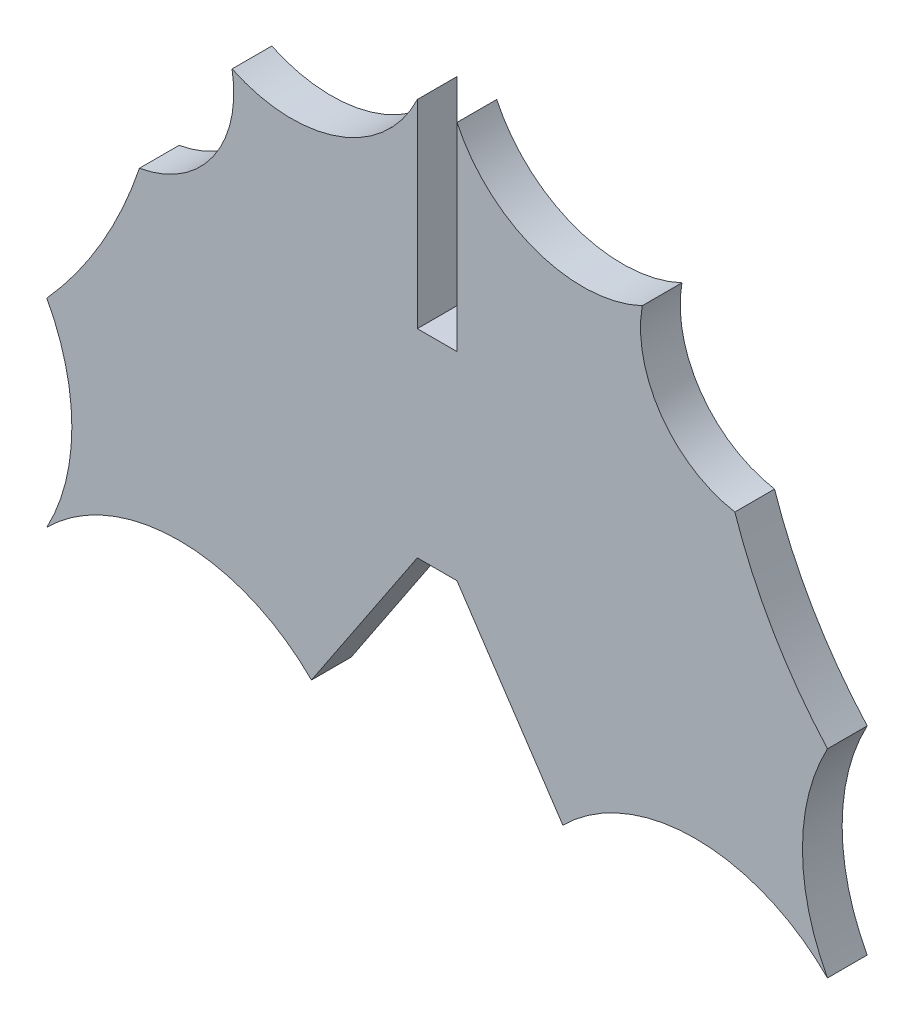
from build123d import *

# Parameters (mm, degrees)
SALIENTE_EXTRUIR2_DEPTH = 3


with BuildPart() as part:
    # Croquis1 → Saliente-Extruir2 (new body)
    with BuildSketch(Plane.XY):
        with BuildLine():
            Line((-7.016617782, 12.62270249), (-10.016617782, 12.62270249))
            Line((-10.016617782, 12.62270249), (-10.016617782, 27.62270249))
            ThreePointArc((-10.016617782, 27.62270249), (-15.981083876, 22.223207554), (-24.016617782, 22.62270249))
            ThreePointArc((-24.016617782, 22.62270249), (-25.44554997, 16.172955022), (-31.016617782, 12.62270249))
            ThreePointArc((-31.016617782, 12.62270249), (-33.901410943, 6.263831835), (-38.016617782, 0.62270249))
            ThreePointArc((-38.016617782, 0.62270249), (-36.124451454, -6.87729751), (-38.016617782, -14.37729751))
            ThreePointArc((-38.016617782, -14.37729751), (-28.016617782, -10.235161886), (-18.016617782, -14.37729751))
            Line((-18.016617782, -14.37729751), (-10.016617782, -2.37729751))
            Line((-10.016617782, -2.37729751), (-7.016617782, -2.37729751))
            Line((-7.016617782, -2.37729751), (0.983382218, -14.37729751))
            ThreePointArc((0.983382218, -14.37729751), (10.983382218, -10.235161886), (20.983382218, -14.37729751))
            ThreePointArc((20.983382218, -14.37729751), (19.09121589, -6.87729751), (20.983382218, 0.62270249))
            ThreePointArc((20.983382218, 0.62270249), (16.868175379, 6.263831835), (13.983382218, 12.62270249))
            ThreePointArc((13.983382218, 12.62270249), (8.412314406, 16.172955022), (6.983382218, 22.62270249))
            ThreePointArc((6.983382218, 22.62270249), (-1.052151688, 22.223207554), (-7.016617782, 27.62270249))
            Line((-7.016617782, 27.62270249), (-7.016617782, 12.62270249))
        make_face()
    extrude(amount=SALIENTE_EXTRUIR2_DEPTH)


solid = part.part
